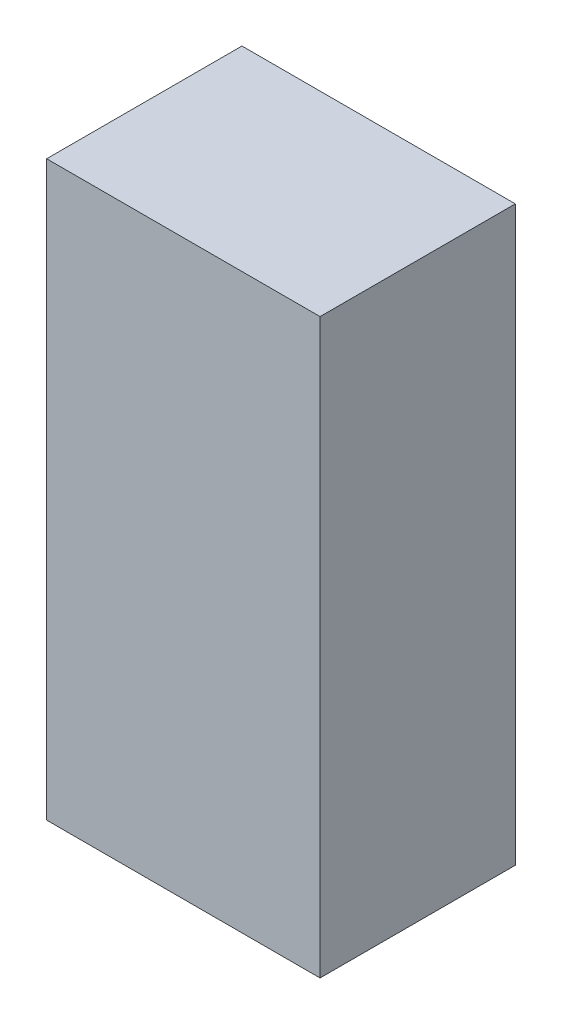
from build123d import *

# Parameters (mm, degrees)
SKETCH_1_W         = 21
SKETCH_1_H         = 44
SIDE_ADAPTER_DEPTH = 15


with BuildPart() as part:
    # 草图1 → Side_adapter (new body)
    with BuildSketch(Plane.XY):
        with Locations((10.5, 22)):
            Rectangle(SKETCH_1_W, SKETCH_1_H)
    extrude(amount=SIDE_ADAPTER_DEPTH)


solid = part.part
